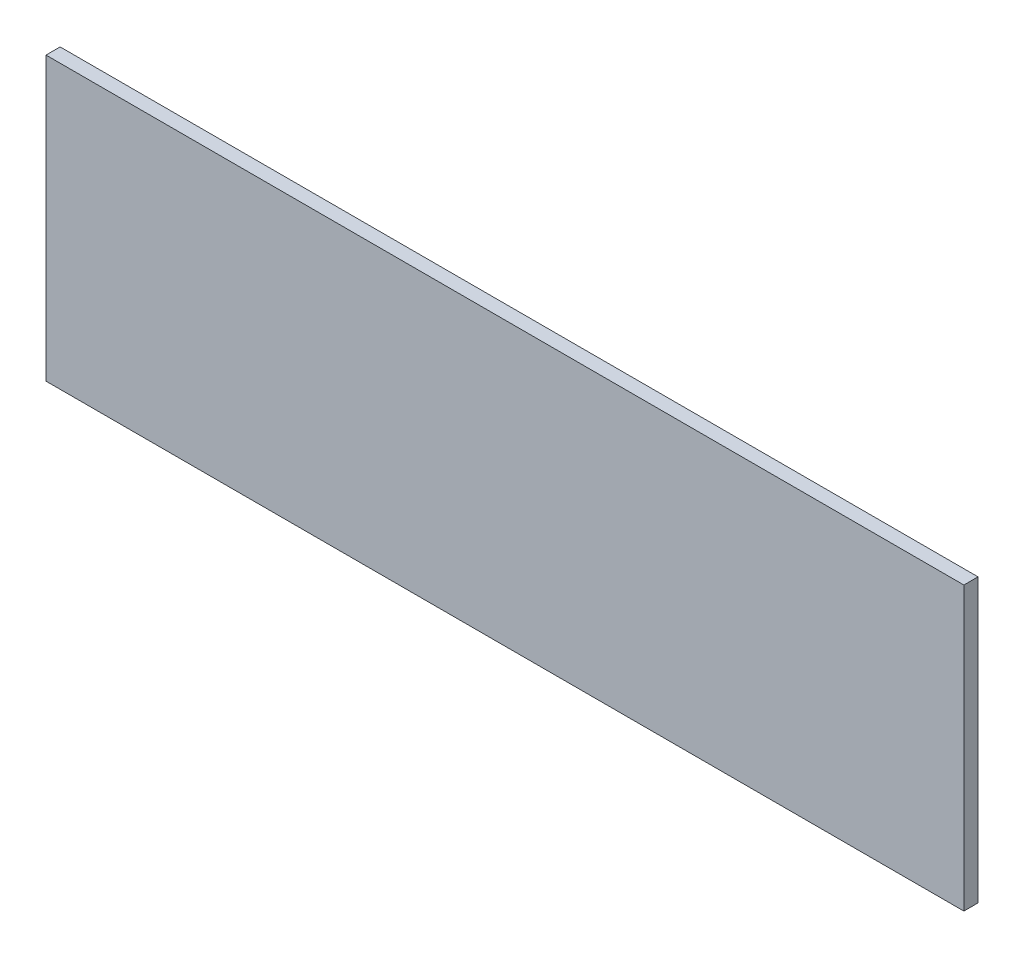
from build123d import *

# Parameters (mm, degrees)
ESQUISSE1_W        = 650
ESQUISSE1_H        = 200
BOSS_EXTRU_1_DEPTH = 10


with BuildPart() as part:
    # Esquisse1 → Boss.-Extru.1 (new body)
    with BuildSketch(Plane.XY):
        with Locations((325, 100)):
            Rectangle(ESQUISSE1_W, ESQUISSE1_H)
    extrude(amount=BOSS_EXTRU_1_DEPTH)


solid = part.part
